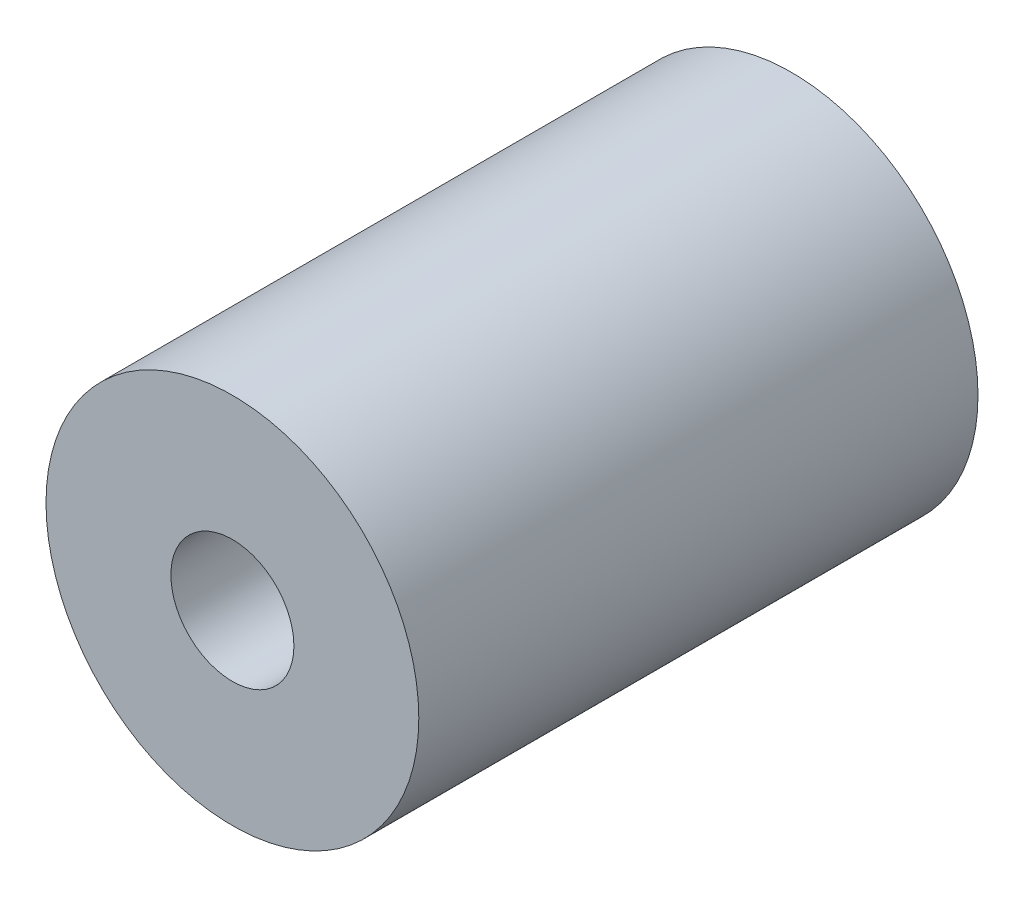
from build123d import *

# Parameters (mm, degrees)
SKETCH_1_R      = 5
SKETCH_1_R_2    = 1.65
EXTRUDE_1_DEPTH = 15


with BuildPart() as part:
    # ｽｹｯﾁ1 → ﾎﾞｽ - 押し出し1 (new body)
    with BuildSketch(Plane.XY):
        Circle(SKETCH_1_R)
        Circle(SKETCH_1_R_2, mode=Mode.SUBTRACT)
    extrude(amount=EXTRUDE_1_DEPTH)


solid = part.part
